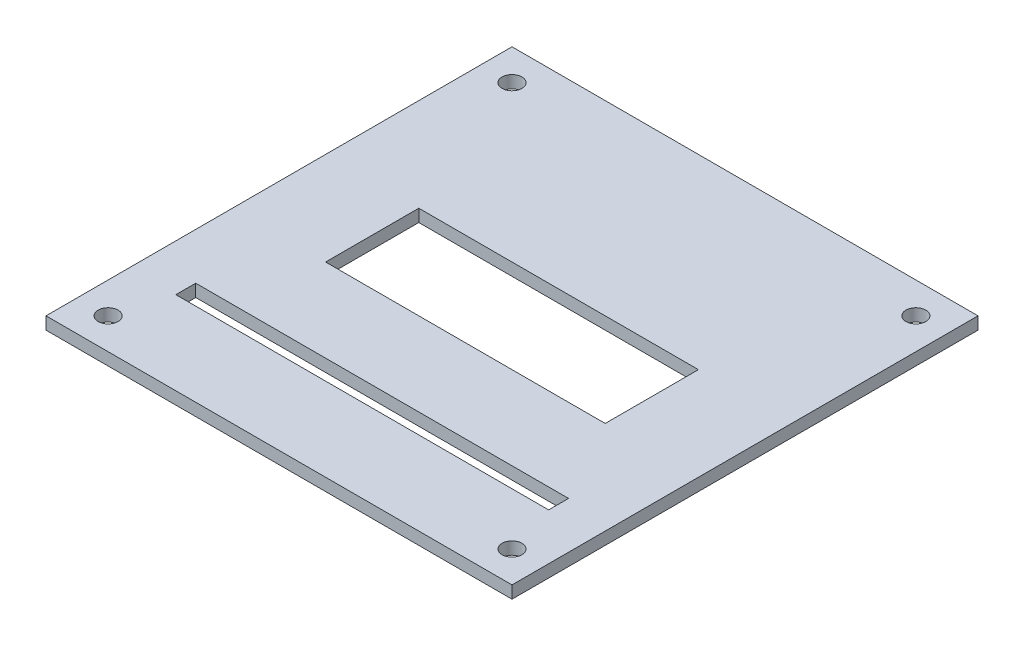
from build123d import *

# Parameters (mm, degrees)
SKETCH1_W           = 75
SKETCH1_H           = 75
SKETCH1_R           = 1.6
BOSS_EXTRUDE1_DEPTH = 2
SKETCH2_W           = 45
SKETCH2_H           = 15
CUT_EXTRUDE1_DEPTH  = 10
SKETCH3_W           = 30
SKETCH3_H           = 3.2
CUT_EXTRUDE2_DEPTH  = 10


with BuildPart() as part:
    # Sketch1 → Boss-Extrude1 (new body)
    with BuildSketch(Plane(origin=(0, 0, 0), x_dir=(1, 0, 0), z_dir=(0, 1, 0))):
        Rectangle(SKETCH1_W, SKETCH1_H)
        with Locations(Location((-32.5, 32.5, 0), (0, 0, 270))):
            Circle(SKETCH1_R, mode=Mode.SUBTRACT)
        with Locations(Location((-32.5, -32.5, 0), (0, 0, 270))):
            Circle(SKETCH1_R, mode=Mode.SUBTRACT)
        with Locations(Location((32.5, 32.5, 0), (0, 0, 270))):
            Circle(SKETCH1_R, mode=Mode.SUBTRACT)
        with Locations(Location((32.5, -32.5, 0), (0, 0, 270))):
            Circle(SKETCH1_R, mode=Mode.SUBTRACT)
    extrude(amount=BOSS_EXTRUDE1_DEPTH)

    # Sketch2 → Cut-Extrude1 (cut)
    with BuildSketch(Plane.XZ):
        Rectangle(SKETCH2_W, SKETCH2_H)
    extrude(amount=-CUT_EXTRUDE1_DEPTH, mode=Mode.SUBTRACT)

    # Sketch3 → Cut-Extrude2 (cut)
    with BuildSketch(Plane.XZ):
        with Locations((-15, 22.5)):
            Rectangle(SKETCH3_W, SKETCH3_H)
        with Locations((15, 22.5)):
            Rectangle(SKETCH3_W, SKETCH3_H)
    extrude(amount=-CUT_EXTRUDE2_DEPTH, mode=Mode.SUBTRACT)


solid = part.part
